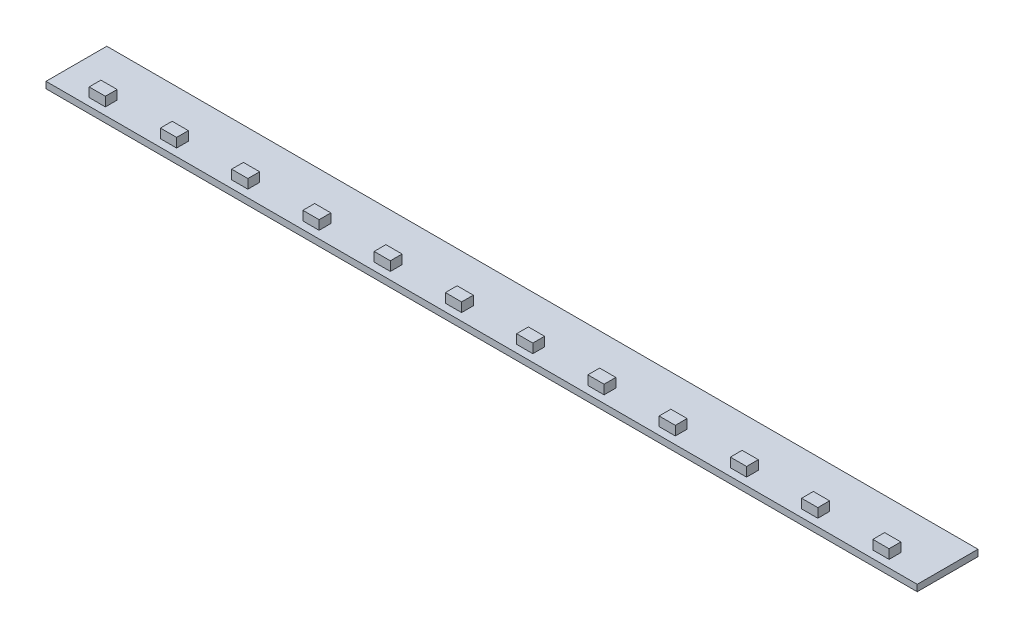
from build123d import *

# Parameters (mm, degrees)
SKETCH2_W           = 215
SKETCH2_H           = 15
BOSS_EXTRUDE1_DEPTH = 1.6
SKETCH4_W           = 4
SKETCH4_H           = 2.9
BOSS_EXTRUDE2_DEPTH = 2.28


with BuildPart() as part:
    # Sketch2 → Boss-Extrude1 (new body)
    with BuildSketch(Plane(origin=(0, 0, 0), x_dir=(1, 0, 0), z_dir=(0, 1, 0))):
        Rectangle(SKETCH2_W, SKETCH2_H)
    extrude(amount=BOSS_EXTRUDE1_DEPTH)

    # Sketch4 → Boss-Extrude2 (add)
    with BuildSketch(Plane(origin=(0, 1.6, 0), x_dir=(1, 0, 0), z_dir=(0, 1, 0))):
        with Locations((-96.7, -4.2)):
            Rectangle(SKETCH4_W, SKETCH4_H)
        with Locations((-79.118, -4.2)):
            Rectangle(SKETCH4_W, SKETCH4_H)
        with Locations((-61.536, -4.2)):
            Rectangle(SKETCH4_W, SKETCH4_H)
        with Locations((-43.955, -4.2)):
            Rectangle(SKETCH4_W, SKETCH4_H)
        with Locations((-26.373, -4.2)):
            Rectangle(SKETCH4_W, SKETCH4_H)
        with Locations((-8.791, -4.2)):
            Rectangle(SKETCH4_W, SKETCH4_H)
        with Locations((8.791, -4.2)):
            Rectangle(SKETCH4_W, SKETCH4_H)
        with Locations((26.373, -4.2)):
            Rectangle(SKETCH4_W, SKETCH4_H)
        with Locations((43.955, -4.2)):
            Rectangle(SKETCH4_W, SKETCH4_H)
        with Locations((61.536, -4.2)):
            Rectangle(SKETCH4_W, SKETCH4_H)
        with Locations((79.118, -4.2)):
            Rectangle(SKETCH4_W, SKETCH4_H)
        with Locations((96.7, -4.2)):
            Rectangle(SKETCH4_W, SKETCH4_H)
    extrude(amount=BOSS_EXTRUDE2_DEPTH)


solid = part.part
